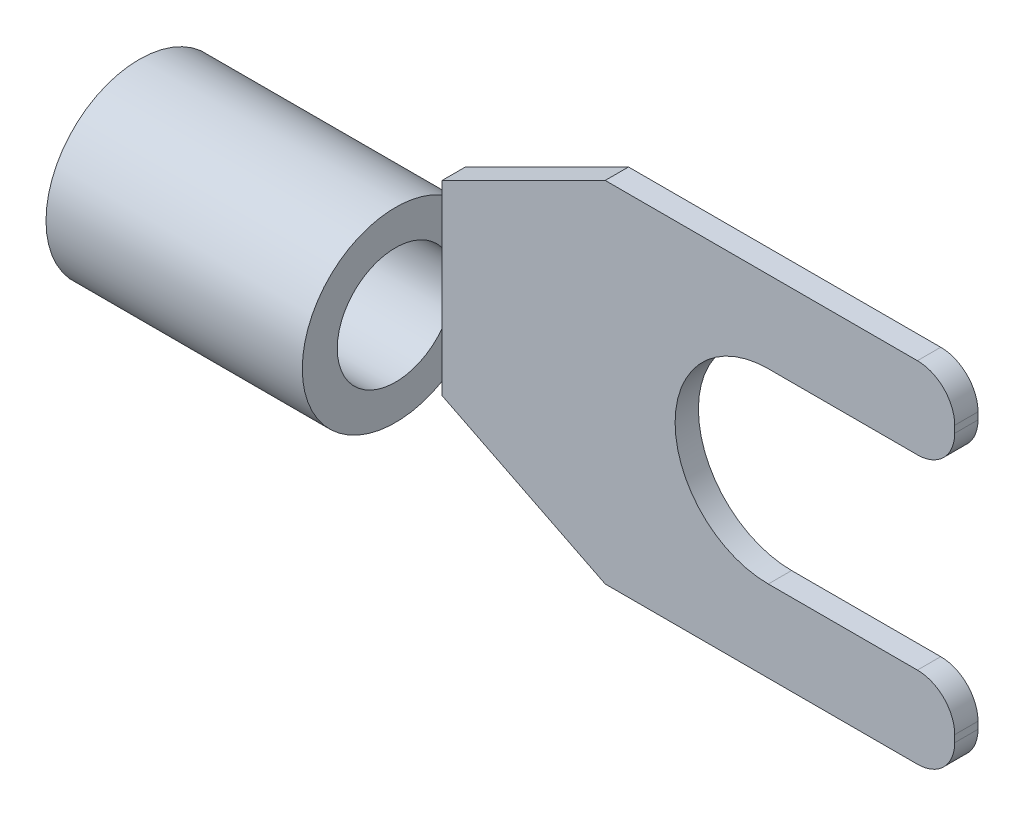
from build123d import *

# Parameters (mm, degrees)
EXTRUDE_1_DEPTH     = 0.5
SKETCH_2_R          = 2
SKETCH_2_R_2        = 1.25
EXTRUDE_2_DEPTH     = 5.5
SKETCH_3_R          = 1.25
CUT_EXTRUDE_1_DEPTH = 5.5
SKETCH_4_R          = 4
SKETCH_4_R_2        = 2
CUT_EXTRUDE_2_DEPTH = 5.5


with BuildPart() as part:
    # 草图1 → 凸台-拉伸1 (new body)
    with BuildSketch(Plane.XY):
        with BuildLine():
            Line((0, 2), (3.2, 2))
            ThreePointArc((3.2, 2), (3.765685425, 2.234314575), (4, 2.8))
            Line((4, 2.8), (4, 2.95))
            ThreePointArc((4, 2.95), (3.765685425, 3.515685425), (3.2, 3.75))
            Line((3.2, 3.75), (-3.5, 3.75))
            Line((-3.5, 3.75), (-7, 2))
            Line((-7, 2), (-12.5, 2))
            Line((-12.5, 2), (-12.5, -2))
            Line((-12.5, -2), (-7, -2))
            Line((-7, -2), (-3.5, -3.75))
            Line((-3.5, -3.75), (3.2, -3.75))
            ThreePointArc((3.2, -3.75), (3.765685425, -3.515685425), (4, -2.95))
            Line((4, -2.95), (4, -2.8))
            ThreePointArc((4, -2.8), (3.765685425, -2.234314575), (3.2, -2))
            Line((3.2, -2), (0, -2))
            ThreePointArc((0, -2), (-2, 0), (0, 2))
        make_face()
    extrude(amount=EXTRUDE_1_DEPTH)

    # 草图2 → 凸台-拉伸2 (add)
    with BuildSketch(Plane.ZY.offset(12.5)):
        with Locations((1.5, 0)):
            Circle(SKETCH_2_R)
        with Locations((1.5, 0)):
            Circle(SKETCH_2_R_2, mode=Mode.SUBTRACT)
    extrude(amount=-EXTRUDE_2_DEPTH)

    # 草图3 → 切除-拉伸1 (cut)
    with BuildSketch(Plane.ZY.offset(12.5)):
        with Locations((1.5, 0)):
            Circle(SKETCH_3_R)
    extrude(amount=-CUT_EXTRUDE_1_DEPTH, mode=Mode.SUBTRACT)

    # 草图4 → 切除-拉伸2 (cut)
    with BuildSketch(Plane.ZY.offset(12.5)):
        with Locations((1.5, 0)):
            Circle(SKETCH_4_R)
        with Locations((1.5, 0)):
            Circle(SKETCH_4_R_2, mode=Mode.SUBTRACT)
    extrude(amount=-CUT_EXTRUDE_2_DEPTH, mode=Mode.SUBTRACT)


solid = part.part
